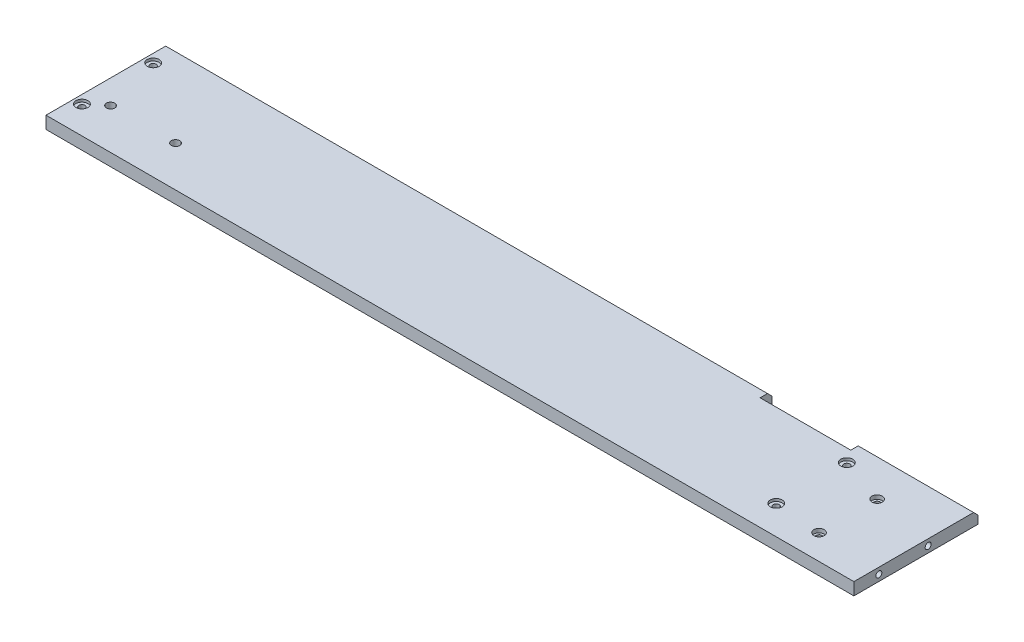
from build123d import *

# Parameters (mm, degrees)
SKETCH1_W           = 622
SKETCH1_H           = 95.56
BOSS_EXTRUDE1_DEPTH = 9.55
HOLE2_D             = 6.5
HOLE5_D             = 4.6
HOLE5_CBORE_D       = 9.2
HOLE5_CBORE_DEPTH   = 2
HOLE6_D             = 4.6
HOLE6_CBORE_D       = 8
HOLE6_CBORE_DEPTH   = 3
CHAMFER1_SIZE       = 3.4
SKETCH16_W          = 69.81
SKETCH16_H          = 9.1
CUT_EXTRUDE1_DEPTH  = 630.370253587
HOLE7_D             = 4.6
HOLE7_DEPTH         = 20


with BuildPart() as part:
    # Sketch1 → Boss-Extrude1 (new body)
    with BuildSketch(Plane(origin=(0, 0, 0), x_dir=(1, 0, 0), z_dir=(0, 1, 0))):
        with Locations((311, -47.78)):
            Rectangle(SKETCH1_W, SKETCH1_H)
    extrude(amount=BOSS_EXTRUDE1_DEPTH)

    # Hole2 (through all)
    with Locations(Plane(origin=(0, 9.55, 0), x_dir=(-1, 0, 0), z_dir=(0, 1, 0))):
        with Locations((-18.475, 64.285), (-68.475, 64.285)):
            Hole(HOLE2_D / 2)

    # Hole5 (through all)
    with Locations(Plane(origin=(0, 9.55, 0), x_dir=(-1, 0, 0), z_dir=(0, 1, 0))):
        with Locations((-6.4, 19.45), (-6.4, 74.31), (-539.95, 18.95), (-539.95, 73.28)):
            CounterBoreHole(HOLE5_D / 2, HOLE5_CBORE_D / 2, HOLE5_CBORE_DEPTH)

    # Hole6 (through all)
    with Locations(Plane(origin=(0, 9.55, 0), x_dir=(-1, 0, 0), z_dir=(0, 1, 0))):
        with Locations((-575.95, 31.61), (-575.95, 76.32)):
            CounterBoreHole(HOLE6_D / 2, HOLE6_CBORE_D / 2, HOLE6_CBORE_DEPTH)

    # Chamfer1
    chamfer1_edges = [part.edges().sort_by_distance(p)[0] for p in [
        (311, 9.55, 0),
    ]]
    chamfer(chamfer1_edges, length=CHAMFER1_SIZE)

    # Sketch16 → Cut-Extrude1 (cut, through all)
    with BuildSketch(Plane.XZ):
        with Locations((498.245, 4.55)):
            Rectangle(SKETCH16_W, SKETCH16_H)
    extrude(amount=-CUT_EXTRUDE1_DEPTH, mode=Mode.SUBTRACT)

    # Hole7
    with Locations(Plane(origin=(622, 0, 0), x_dir=(0, 0, -1), z_dir=(1, 0, 0))):
        with Locations((-76.36, 4.775), (-38.38, 4.775)):
            Hole(HOLE7_D / 2, depth=HOLE7_DEPTH)


solid = part.part
